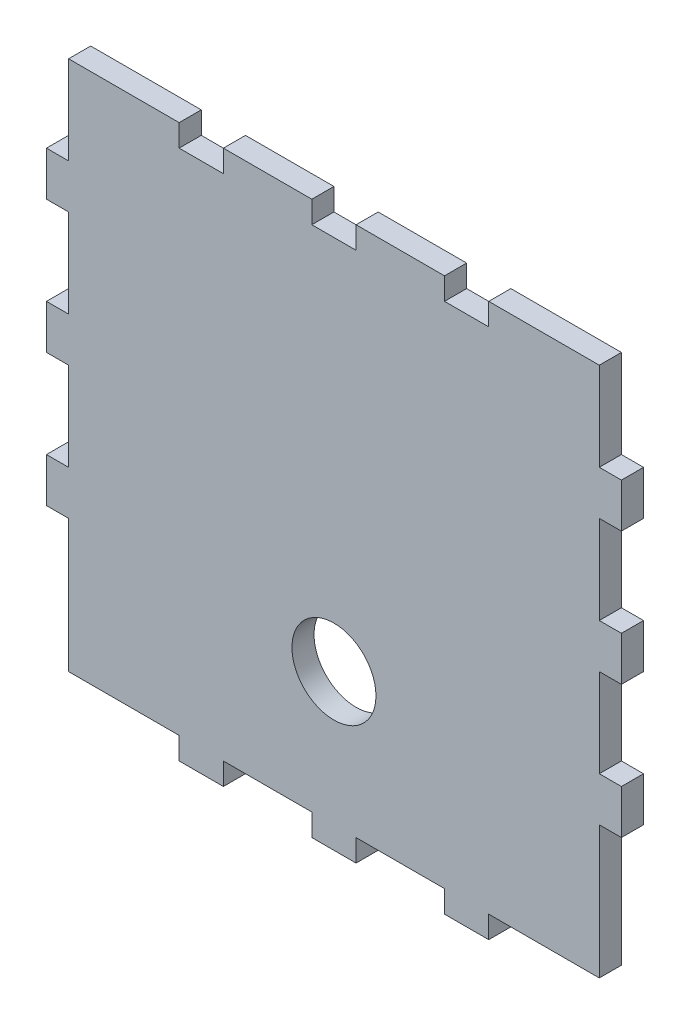
from build123d import *

# Parameters (mm, degrees)
SKETCH1_R           = 9.5
BOSS_EXTRUDE1_DEPTH = 5


with BuildPart() as part:
    # Sketch1 → Boss-Extrude1 (new body)
    with BuildSketch(Plane.XY):
        Polygon((-35, 60), (-35, 55), (-25, 55), (-25, 60), (-5, 60), (-5, 55), (5, 55), (5, 60), (25, 60), (25, 55), (35, 55), (35, 60), (60, 60), (60, 40), (65, 40), (65, 30), (60, 30), (60, 10), (65, 10), (65, 0), (60, 0), (60, -20), (65, -20), (65, -30), (60, -30), (60, -60), (35, -60), (35, -65), (25, -65), (25, -60), (5, -60), (5, -65), (-5, -65), (-5, -60), (-25, -60), (-25, -65), (-35, -65), (-35, -60), (-60, -60), (-60, -30), (-65, -30), (-65, -20), (-60, -20), (-60, 0), (-65, 0), (-65, 10), (-60, 10), (-60, 30), (-65, 30), (-65, 40), (-60, 40), (-60, 60), align=None)
        with Locations((0, -30)):
            Circle(SKETCH1_R, mode=Mode.SUBTRACT)
    extrude(amount=BOSS_EXTRUDE1_DEPTH)


solid = part.part
